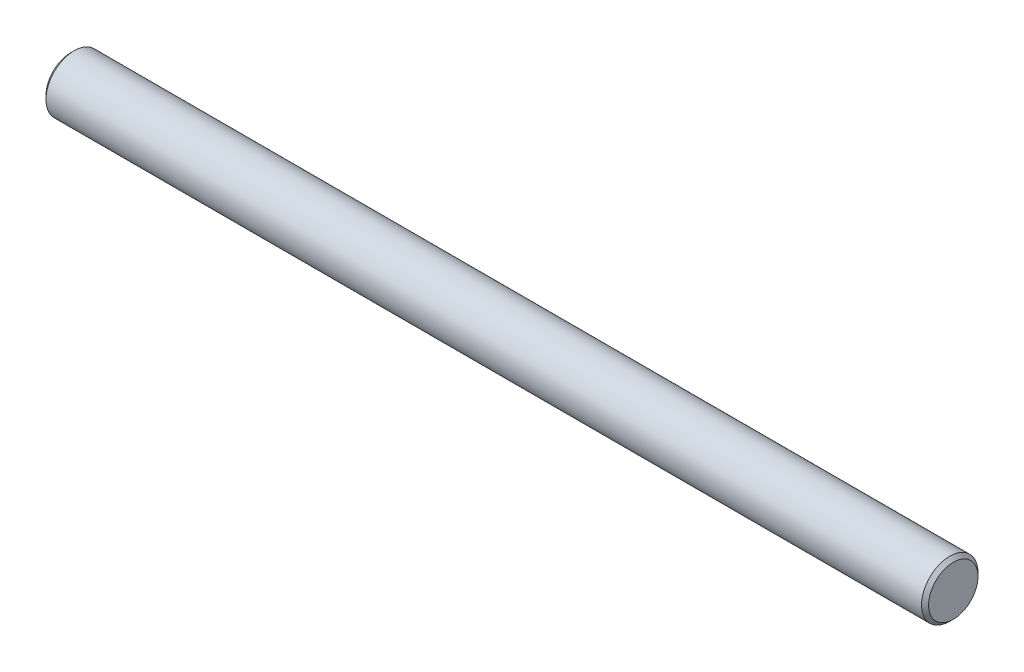
from build123d import *

# Parameters (mm, degrees)
SKETCH1_R           = 4
BOSS_EXTRUDE1_DEPTH = 125
CHAMFER1_SIZE       = 0.5


with BuildPart() as part:
    # Sketch1 → Boss-Extrude1 (new body)
    with BuildSketch(Plane(origin=(0, 0, 0), x_dir=(0, 0, -1), z_dir=(1, 0, 0))):
        Circle(SKETCH1_R)
    extrude(amount=BOSS_EXTRUDE1_DEPTH)

    # Chamfer1
    chamfer1_edges = [part.edges().sort_by_distance(p)[0] for p in [
        (0, 0, 4),
        (125, 0, 4),
    ]]
    chamfer(chamfer1_edges, length=CHAMFER1_SIZE)


solid = part.part
